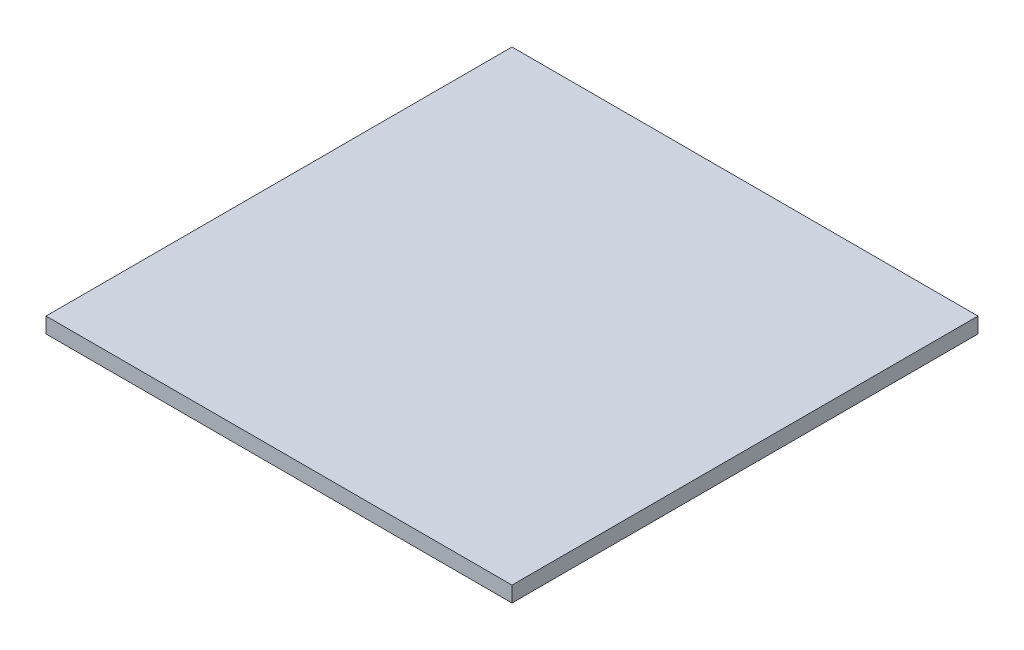
from build123d import *

# Parameters (mm, degrees)
SKETCH2_W           = 300
SKETCH2_H           = 300
BOSS_EXTRUDE1_DEPTH = 10


with BuildPart() as part:
    # Sketch2 → Boss-Extrude1 (new body)
    with BuildSketch(Plane(origin=(0, 0, 0), x_dir=(1, 0, 0), z_dir=(0, 1, 0))):
        with Locations((150, 150)):
            Rectangle(SKETCH2_W, SKETCH2_H)
    extrude(amount=BOSS_EXTRUDE1_DEPTH)


solid = part.part
